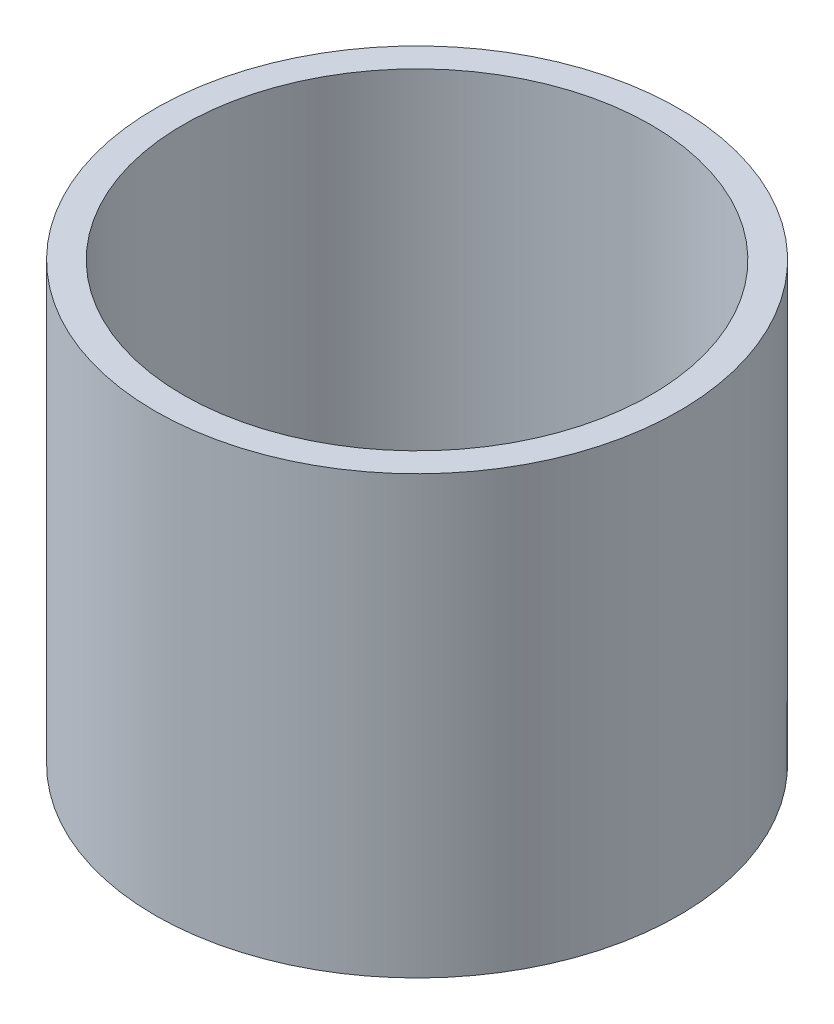
from build123d import *

# Parameters (mm, degrees)
SKETCH1_R           = 84
SKETCH1_R_2         = 75
BOSS_EXTRUDE1_DEPTH = 140


with BuildPart() as part:
    # Sketch1 → Boss-Extrude1 (new body)
    with BuildSketch(Plane(origin=(0, 0, 0), x_dir=(1, 0, 0), z_dir=(0, 1, 0))):
        with Locations(Location((0, 0, 0), (0, 0, 270))):
            Circle(SKETCH1_R)
        with Locations(Location((0, 0, 0), (0, 0, 270))):
            Circle(SKETCH1_R_2, mode=Mode.SUBTRACT)
    extrude(amount=BOSS_EXTRUDE1_DEPTH)


solid = part.part
